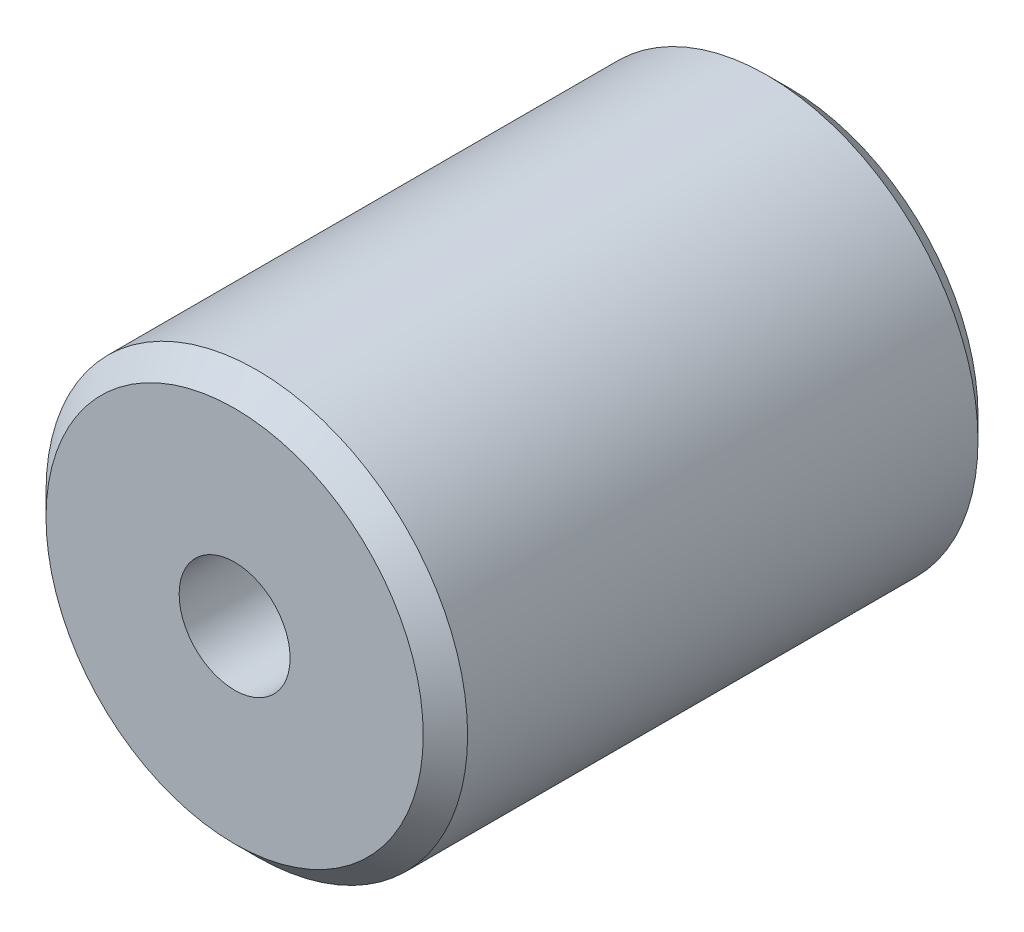
from build123d import *

# Parameters (mm, degrees)
SKETCH_1_R          = 9.5
SKETCH_1_R_2        = 2.5
EXTRUDE_1_DEPTH     = 25
CHAMFER_1_SIZE      = 1
SKETCH_2_R          = 4
CUT_EXTRUDE_1_DEPTH = 18


with BuildPart() as part:
    # 草图1 → 凸台-拉伸1 (new body)
    with BuildSketch(Plane.XY):
        Circle(SKETCH_1_R)
        Circle(SKETCH_1_R_2, mode=Mode.SUBTRACT)
    extrude(amount=EXTRUDE_1_DEPTH)

    # 倒角1
    chamfer_1_edges = [part.edges().sort_by_distance(p)[0] for p in [
        (-9.5, 0, 0),
        (-9.5, 0, 25),
    ]]
    chamfer(chamfer_1_edges, length=CHAMFER_1_SIZE)

    # 草图2 → 切除-拉伸1 (cut)
    with BuildSketch(Plane(origin=(0, 0, 0), x_dir=(-1, 0, 0), z_dir=(0, 0, -1))):
        Circle(SKETCH_2_R)
    extrude(amount=-CUT_EXTRUDE_1_DEPTH, mode=Mode.SUBTRACT)


solid = part.part
